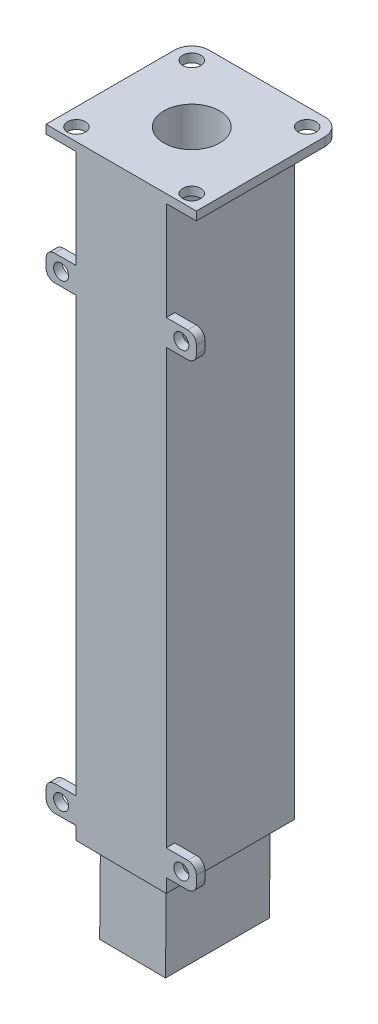
from build123d import *

# Parameters (mm, degrees)
ESQUISSE1_W                  = 35
ESQUISSE1_H                  = 35
BOSS_EXTRU_1_DEPTH           = 2
ESQUISSE2_R                  = 1.75
ESQUISSE2_W                  = 35
ESQUISSE2_H                  = 1.064971157
ENL_V_MAT_EXTRU_1_DEPTH      = 2
BOSS_EXTRU_2_DEPTH           = 280
ESQUISSE5_W                  = 7
ESQUISSE5_H                  = 6
ESQUISSE5_R                  = 1.75
BOSS_EXTRU_3_DEPTH           = 2
ESQUISSE6_R                  = 1.75
BOSS_EXTRU_4_DEPTH           = 2
ESQUISSE10_W                 = 35
ESQUISSE10_H                 = 33.935028843
ESQUISSE10_R                 = 1.75
BOSS_EXTRU_5_DEPTH           = 2
ESQUISSE15_R                 = 6.5
ESQUISSE15_R_2               = 1.75
ENL_V_MAT_EXTRU_2_DEPTH      = 373
CONG_1_R                     = 2
CONG_2_R                     = 4
ESQUISSE17_R                 = 1.75
BOSS_EXTRU_6_DEPTH           = 2
ENL_V_MAT_EXTRU_3_DEPTH      = 2
ENL_V_MAT_EXTRU_4_DEPTH      = 128
ENL_V_MAT_EXTRU_4_DEPTH_BACK = 307
ESQUISSE20_W                 = 15.344018475
ESQUISSE20_H                 = 24.213203648
ESQUISSE20_R                 = 6.5
BOSS_EXTRU_7_DEPTH           = 20
ESQUISSE21_R                 = 2.1
ENL_V_MAT_EXTRU_5_DEPTH      = 10


with BuildPart() as part:
    # Esquisse1 → Boss.-Extru.1 (new body)
    with BuildSketch(Plane(origin=(0, 0, 0), x_dir=(1, 0, 0), z_dir=(0, 1, 0))):
        with Locations((17.5, -17.5)):
            Rectangle(ESQUISSE1_W, ESQUISSE1_H)
    extrude(amount=BOSS_EXTRU_1_DEPTH)

    # Esquisse2 → Enlèv. mat.-Extru.1 (cut)
    with BuildSketch(Plane(origin=(0, 2, 0), x_dir=(1, 0, 0), z_dir=(0, 1, 0))):
        with Locations(Location((30.935029054, -4.064971369, 0), (0, 0, 270))):
            Circle(ESQUISSE2_R)
        with Locations(Location((30.935028843, -30.935028843, 0), (0, 0, 270))):
            Circle(ESQUISSE2_R)
        with Locations(Location((4.064971369, -4.064970946, 0), (0, 0, 270))):
            Circle(ESQUISSE2_R)
        with Locations(Location((4.064971157, -30.935028843, 0), (0, 0, 270))):
            Circle(ESQUISSE2_R)
        with Locations((17.5, -34.467514421)):
            Rectangle(ESQUISSE2_W, ESQUISSE2_H)
    extrude(amount=-ENL_V_MAT_EXTRU_1_DEPTH, mode=Mode.SUBTRACT)

    # Esquisse4 → Boss.-Extru.2 (add)
    with BuildSketch(Plane(origin=(0, 2, 0), x_dir=(1, 0, 0), z_dir=(0, 1, 0))):
        Polygon((17.5, -33.935028843), (7, -33.935028843), (7, -4.064970946), (28, -4.064970946), (28, -33.935028843), align=None)
    extrude(amount=BOSS_EXTRU_2_DEPTH)

    # Esquisse5 → Boss.-Extru.3 (add)
    # profile 1 of 4: a face of its own
    with BuildSketch(Plane.XY.offset(33.935028843)):
        with Locations((31.5, 254)):
            Rectangle(ESQUISSE5_W, ESQUISSE5_H)
        with Locations((31.5, 254)):
            Circle(ESQUISSE5_R, mode=Mode.SUBTRACT)
    # profile 2 of 4: a face of its own
    with BuildSketch(Plane.XY.offset(33.935028843)):
        with Locations((3.5, 254)):
            Rectangle(ESQUISSE5_W, ESQUISSE5_H)
        with Locations((3.5, 254)):
            Circle(ESQUISSE5_R, mode=Mode.SUBTRACT)
    # profile 3 of 4: a face of its own
    with BuildSketch(Plane.XY.offset(33.935028843)):
        with Locations((31.5, 28)):
            Rectangle(ESQUISSE5_W, ESQUISSE5_H)
        with Locations((31.5, 28)):
            Circle(ESQUISSE5_R, mode=Mode.SUBTRACT)
    # profile 4 of 4: a face of its own
    with BuildSketch(Plane.XY.offset(33.935028843)):
        with Locations((3.5, 28)):
            Rectangle(ESQUISSE5_W, ESQUISSE5_H)
        with Locations((3.5, 28)):
            Circle(ESQUISSE5_R, mode=Mode.SUBTRACT)
    extrude(amount=-BOSS_EXTRU_3_DEPTH)

    # Esquisse6 → Boss.-Extru.4 (add)
    # profile 1 of 2: a face of its own
    with BuildSketch(Plane.XY.offset(33.935028843)):
        Polygon((7, 144), (0, 144), (0, 141), (0, 138), (7, 138), (7, 141), align=None)
        with Locations((3.5, 141)):
            Circle(ESQUISSE6_R, mode=Mode.SUBTRACT)
    # profile 2 of 2: a face of its own
    with BuildSketch(Plane.XY.offset(33.935028843)):
        Polygon((35, 144), (28, 144), (28, 141), (28, 138), (35, 138), (35, 141), align=None)
        with Locations((31.5, 141)):
            Circle(ESQUISSE6_R, mode=Mode.SUBTRACT)
    extrude(amount=-BOSS_EXTRU_4_DEPTH)

    # Esquisse10 → Boss.-Extru.5 (add)
    with BuildSketch(Plane(origin=(0, 282, 0), x_dir=(1, 0, 0), z_dir=(0, 1, 0))):
        with Locations((17.5, -16.967514422)):
            Rectangle(ESQUISSE10_W, ESQUISSE10_H)
        with Locations(Location((30.935028843, -30.935028843, 0), (0, 0, 270))):
            Circle(ESQUISSE10_R, mode=Mode.SUBTRACT)
        with Locations(Location((30.935028631, -4.064970946, 0), (0, 0, 270.000013863))):
            Circle(ESQUISSE10_R, mode=Mode.SUBTRACT)
        with Locations(Location((4.064970946, -4.064971369, 0), (0, 0, 270.000013863))):
            Circle(ESQUISSE10_R, mode=Mode.SUBTRACT)
        with Locations(Location((4.064971157, -30.935028843, 0), (0, 0, 270))):
            Circle(ESQUISSE10_R, mode=Mode.SUBTRACT)
    extrude(amount=-BOSS_EXTRU_5_DEPTH)

    # Esquisse15 → Enlèv. mat.-Extru.2 (cut)
    with BuildSketch(Plane(origin=(0, 282, 0), x_dir=(1, 0, 0), z_dir=(0, 1, 0))):
        with Locations(Location((17.5, -17.5, 0), (0, 0, 270))):
            Circle(ESQUISSE15_R)
        with Locations(Location((30.935029054, -4.064971369, 0), (0, 0, 270))):
            Circle(ESQUISSE15_R_2)
    extrude(amount=-ENL_V_MAT_EXTRU_2_DEPTH, mode=Mode.SUBTRACT)

    # Congé1
    cong_1_edges = [part.edges().sort_by_distance(p)[0] for p in [
        (0, 31, 32.935028843),
        (0, 25, 32.935028843),
        (0, 144, 32.935028843),
        (0, 138, 32.935028843),
        (35, 144, 32.935028843),
        (35, 138, 32.935028843),
        (35, 257, 32.935028843),
        (35, 251, 32.935028843),
        (0, 251, 32.935028843),
        (0, 257, 32.935028843),
        (35, 31, 32.935028843),
        (35, 25, 32.935028843),
    ]]
    fillet(cong_1_edges, radius=CONG_1_R)

    # Congé2
    cong_2_edges = [part.edges().sort_by_distance(p)[0] for p in [
        (35, 281, 0),
        (0, 281, 0),
        (0, 1, 0),
        (35, 1, 0),
    ]]
    fillet(cong_2_edges, radius=CONG_2_R)

    # Esquisse17 → Boss.-Extru.6 (add)
    # profile 1 of 4: a face of its own
    with BuildSketch(Plane.XY.offset(33.935028843)):
        with BuildLine():
            Line((0, 148), (0, 146))
            ThreePointArc((0, 146), (0.585786438, 144.585786438), (2, 144))
            Line((2, 144), (7, 144))
            Line((7, 144), (7, 150))
            Line((7, 150), (2, 150))
            ThreePointArc((2, 150), (0.585786438, 149.414213562), (0, 148))
        make_face()
        with Locations((3.5, 147)):
            Circle(ESQUISSE17_R, mode=Mode.SUBTRACT)
    # profile 2 of 4: a face of its own
    with BuildSketch(Plane.XY.offset(33.935028843)):
        with BuildLine():
            Line((0, 136), (0, 134))
            ThreePointArc((0, 134), (0.585786438, 132.585786438), (2, 132))
            Line((2, 132), (7, 132))
            Line((7, 132), (7, 138))
            Line((7, 138), (2, 138))
            ThreePointArc((2, 138), (0.585786438, 137.414213562), (0, 136))
        make_face()
        with Locations((3.5, 135)):
            Circle(ESQUISSE17_R, mode=Mode.SUBTRACT)
    # profile 3 of 4: a face of its own
    with BuildSketch(Plane.XY.offset(33.935028843)):
        with BuildLine():
            ThreePointArc((35, 134), (34.414213562, 132.585786438), (33, 132))
            Line((33, 132), (28, 132))
            Line((28, 132), (28, 138))
            Line((28, 138), (33, 138))
            ThreePointArc((33, 138), (34.414213562, 137.414213562), (35, 136))
            Line((35, 136), (35, 134))
        make_face()
        with Locations((31.5, 135)):
            Circle(ESQUISSE17_R, mode=Mode.SUBTRACT)
    # profile 4 of 4: a face of its own
    with BuildSketch(Plane.XY.offset(33.935028843)):
        with BuildLine():
            ThreePointArc((35, 146), (34.414213562, 144.585786438), (33, 144))
            Line((33, 144), (28, 144))
            Line((28, 144), (28, 150))
            Line((28, 150), (33, 150))
            ThreePointArc((33, 150), (34.414213562, 149.414213562), (35, 148))
            Line((35, 148), (35, 146))
        make_face()
        with Locations((31.5, 147)):
            Circle(ESQUISSE17_R, mode=Mode.SUBTRACT)
    extrude(amount=-BOSS_EXTRU_6_DEPTH)

    # Esquisse18 → Enlèv. mat.-Extru.3 (cut)
    with BuildSketch(Plane.XY.offset(33.935028843)):
        Polygon((2, 138), (7, 138), (7, 144), (2, 144), (-2.362534847, 144), (-2.362534847, 138), align=None)
        Polygon((37.362534847, 138), (33, 138), (28, 138), (28, 144), (33, 144), (37.362534847, 144), align=None)
    extrude(amount=-ENL_V_MAT_EXTRU_3_DEPTH, mode=Mode.SUBTRACT)

    # Esquisse19 → Enlèv. mat.-Extru.4 (cut, two sides: drawn at the far end of the back side and taken through both)
    with BuildSketch(Plane.XY.offset(33.935028843).offset(-ENL_V_MAT_EXTRU_4_DEPTH_BACK)):
        Polygon((7, 141), (140.120509387, 139.786349695), (140.120509387, -30.380281214), (-166.15037202, -30.380281214), (-166.15037202, 141), align=None)
    extrude(amount=ENL_V_MAT_EXTRU_4_DEPTH + ENL_V_MAT_EXTRU_4_DEPTH_BACK, mode=Mode.SUBTRACT)

    # Esquisse20 → Boss.-Extru.7 (add)
    with BuildSketch(Plane(origin=(1.285962007, 141.052094482, 0), x_dir=(0.999958443388445, -0.009116550672166258, 0), z_dir=(-0.009116550672166258, -0.9999584433884451, 0))):
        with Locations((16.214711822, 18.999999894)):
            Rectangle(ESQUISSE20_W, ESQUISSE20_H)
        with Locations(Location((16.214711821, 17.5, 0), (0, 0, 270))):
            Circle(ESQUISSE20_R, mode=Mode.SUBTRACT)
    extrude(amount=BOSS_EXTRU_7_DEPTH)

    # Esquisse21 → Enlèv. mat.-Extru.5 (cut)
    with BuildSketch(Plane.XZ.offset(-280)):
        with Locations(Location((4.064970946, 4.064971369, 0), (0, 0, 270))):
            Circle(ESQUISSE21_R)
        with Locations(Location((30.935028631, 4.064970946, 0), (0, 0, 270))):
            Circle(ESQUISSE21_R)
        with Locations(Location((30.935028843, 30.935028843, 0), (0, 0, 270))):
            Circle(ESQUISSE21_R)
        with Locations(Location((4.064971157, 30.935028843, 0), (0, 0, 270))):
            Circle(ESQUISSE21_R)
    extrude(amount=-ENL_V_MAT_EXTRU_5_DEPTH, mode=Mode.SUBTRACT)


solid = part.part
